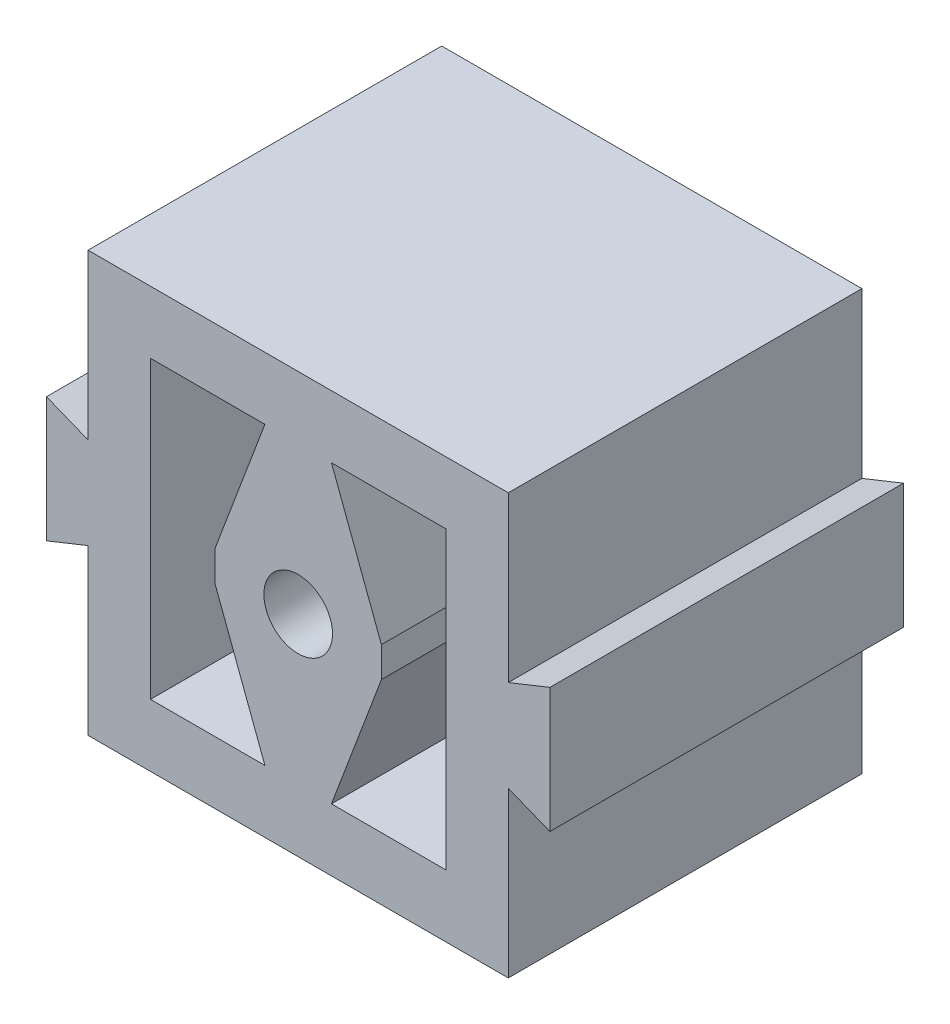
from build123d import *

# Parameters (mm, degrees)
SKETCH1_W           = 50.5
SKETCH1_H           = 50.5
BOSS_EXTRUDE1_DEPTH = 42.5
SKETCH2_R           = 4.125
CUT_EXTRUDE1_DEPTH  = 46.2
CUT_EXTRUDE2_DEPTH  = 76


with BuildPart() as part:
    # Sketch1 → Boss-Extrude1 (new body)
    with BuildSketch(Plane.XY):
        Rectangle(SKETCH1_W, SKETCH1_H)
        Polygon((-25.25, -5.5), (-25.25, 5.5), (-30.25, 7.5), (-30.25, -7.5), align=None)
        Polygon((30.25, 7.5), (25.25, 5.5), (25.25, -5.5), (30.25, -7.5), align=None)
    extrude(amount=BOSS_EXTRUDE1_DEPTH)

    # Sketch2 → Cut-Extrude1 (cut)
    with BuildSketch(Plane.XY.offset(42.5)):
        Circle(SKETCH2_R)
    extrude(amount=-CUT_EXTRUDE1_DEPTH, mode=Mode.SUBTRACT)

    # Sketch4 → Cut-Extrude2 (cut)
    with BuildSketch(Plane.XY.offset(42.5)):
        Polygon((-17.75, -17.75), (-17.75, 17.75), (-4, 17.75), (-10, 1.820899919), (-10, -1.820899919), (-4, -17.75), align=None)
        Polygon((10, -1.820899919), (4, -17.75), (17.75, -17.75), (17.75, 17.75), (4, 17.75), (10, 1.820899919), align=None)
    extrude(amount=-CUT_EXTRUDE2_DEPTH, mode=Mode.SUBTRACT)


solid = part.part
